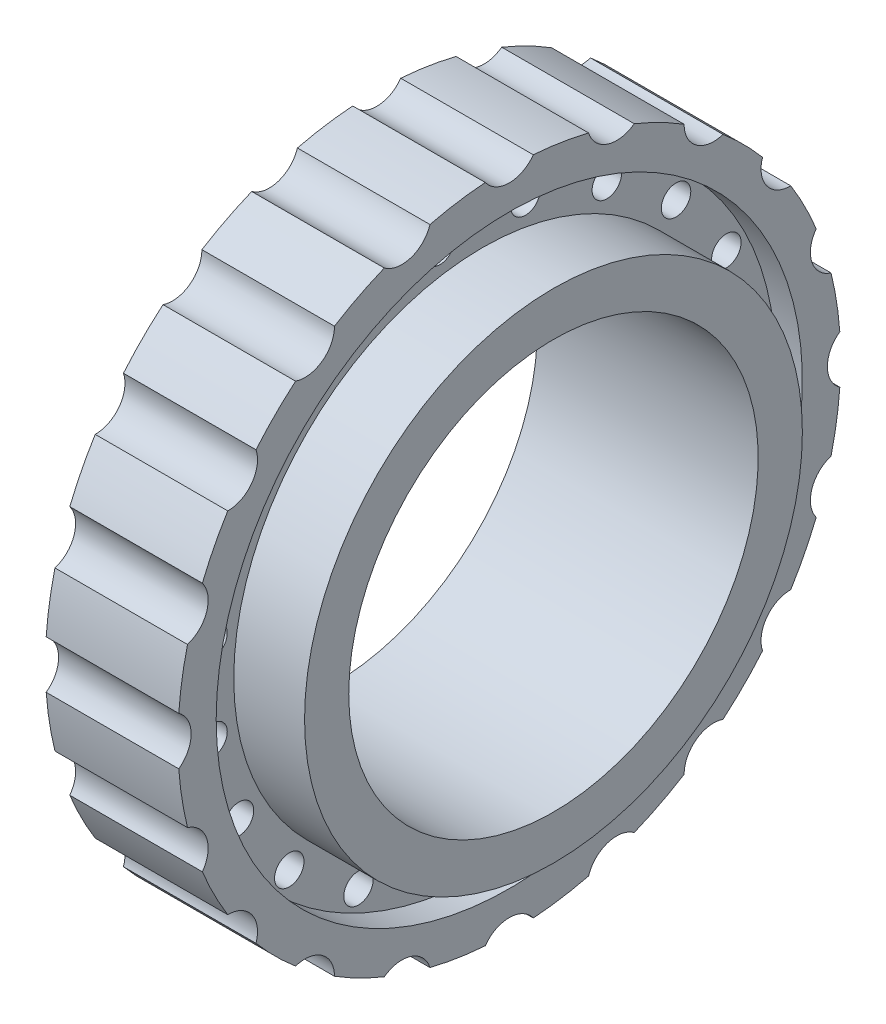
from build123d import *

# Parameters (mm, degrees)
CUT_EXTRUDE1_DEPTH      = 33.691742077
CUT_EXTRUDE1_DEPTH_BACK = 33.691742077
SKETCH3_R               = 2
SKETCH3_R_2             = 1


with BuildPart() as part:
    # Sketch2 → Revolve1 (revolve)
    with BuildSketch(Plane.XY, mode=Mode.PRIVATE) as revolve1_sk:
        Polygon((7.5, 13.9), (-7.5, 13.9), (-7.5, 16.9), (-2.692932377, 16.9), (-2.692932377, 19.9), (-4.5, 19.9), (-4.5, 22.5), (4.5, 22.5), (4.5, 19.9), (2.692932377, 19.9), (2.692932377, 16.9), (7.5, 16.9), align=None)
    revolve(revolve1_sk.sketch.rotate(Axis((-32.720414201, 0, 0), (1, 0, 0)), 90), axis=Axis((-32.720414201, 0, 0), (1, 0, 0)))

    # Sketch3 → Cut-Extrude1 (cut, two sides: drawn at the far end of the back side and taken through both)
    with BuildSketch(Plane(origin=(0, 0, 0), x_dir=(0, 0, -1), z_dir=(1, 0, 0)).offset(-CUT_EXTRUDE1_DEPTH_BACK)):
        with Locations((7.292672674, 22.444538631)):
            Circle(SKETCH3_R)
        with Locations((-2.904929565, 18.34100344)):
            Circle(SKETCH3_R_2)
        with Locations((13.871487736, 19.09246493)):
            Circle(SKETCH3_R)
        with Locations((19.09246493, 13.871487736)):
            Circle(SKETCH3_R)
        with Locations((22.444538631, 7.292672674)):
            Circle(SKETCH3_R)
        with Locations((23.599584511, 0)):
            Circle(SKETCH3_R)
        with Locations((22.444538631, -7.292672674)):
            Circle(SKETCH3_R)
        with Locations((19.09246493, -13.871487736)):
            Circle(SKETCH3_R)
        with Locations((13.871487736, -19.09246493)):
            Circle(SKETCH3_R)
        with Locations((7.292672674, -22.444538631)):
            Circle(SKETCH3_R)
        with Locations((0, -23.599584511)):
            Circle(SKETCH3_R)
        with Locations((-7.292672674, -22.444538631)):
            Circle(SKETCH3_R)
        with Locations((-13.871487736, -19.09246493)):
            Circle(SKETCH3_R)
        with Locations((-19.09246493, -13.871487736)):
            Circle(SKETCH3_R)
        with Locations((-22.444538631, -7.292672674)):
            Circle(SKETCH3_R)
        with Locations((-23.599584511, 0)):
            Circle(SKETCH3_R)
        with Locations((-22.444538631, 7.292672674)):
            Circle(SKETCH3_R)
        with Locations((-19.09246493, 13.871487736)):
            Circle(SKETCH3_R)
        with Locations((-13.871487736, 19.09246493)):
            Circle(SKETCH3_R)
        with Locations((-7.292672674, 22.444538631)):
            Circle(SKETCH3_R)
        with Locations((0, 23.599584511)):
            Circle(SKETCH3_R)
        with Locations((2.904929565, 18.34100344)):
            Circle(SKETCH3_R_2)
        with Locations((8.430433949, 16.545658234)):
            Circle(SKETCH3_R_2)
        with Locations((13.13070872, 13.13070872)):
            Circle(SKETCH3_R_2)
        with Locations((16.545658234, 8.430433949)):
            Circle(SKETCH3_R_2)
        with Locations((18.34100344, 2.904929565)):
            Circle(SKETCH3_R_2)
        with Locations((18.34100344, -2.904929565)):
            Circle(SKETCH3_R_2)
        with Locations((16.545658234, -8.430433949)):
            Circle(SKETCH3_R_2)
        with Locations((13.13070872, -13.13070872)):
            Circle(SKETCH3_R_2)
        with Locations((8.430433949, -16.545658234)):
            Circle(SKETCH3_R_2)
        with Locations((2.904929565, -18.34100344)):
            Circle(SKETCH3_R_2)
        with Locations((-2.904929565, -18.34100344)):
            Circle(SKETCH3_R_2)
        with Locations((-8.430433949, -16.545658234)):
            Circle(SKETCH3_R_2)
        with Locations((-13.13070872, -13.13070872)):
            Circle(SKETCH3_R_2)
        with Locations((-16.545658234, -8.430433949)):
            Circle(SKETCH3_R_2)
        with Locations((-18.34100344, -2.904929565)):
            Circle(SKETCH3_R_2)
        with Locations((-18.34100344, 2.904929565)):
            Circle(SKETCH3_R_2)
        with Locations((-16.545658234, 8.430433949)):
            Circle(SKETCH3_R_2)
        with Locations((-13.13070872, 13.13070872)):
            Circle(SKETCH3_R_2)
        with Locations((-8.430433949, 16.545658234)):
            Circle(SKETCH3_R_2)
    extrude(amount=CUT_EXTRUDE1_DEPTH + CUT_EXTRUDE1_DEPTH_BACK, mode=Mode.SUBTRACT)


solid = part.part
